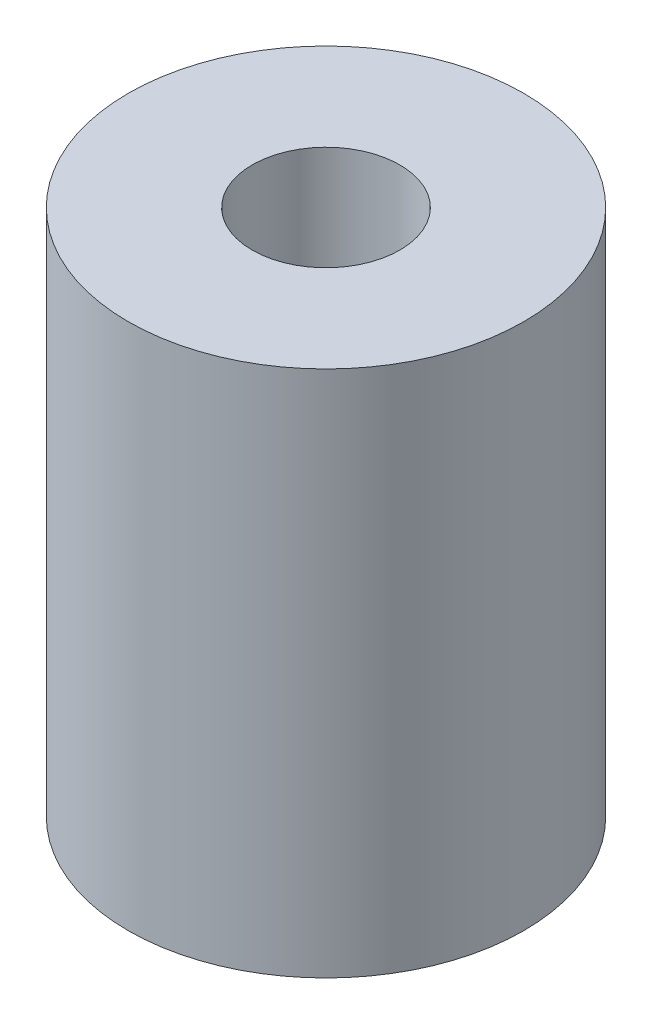
from build123d import *

# Parameters (mm, degrees)
SKETCH1_R           = 7.5
SKETCH1_R_2         = 2.8
BOSS_EXTRUDE1_DEPTH = 20


with BuildPart() as part:
    # Sketch1 → Boss-Extrude1 (new body)
    with BuildSketch(Plane(origin=(0, 0, 0), x_dir=(1, 0, 0), z_dir=(0, 1, 0))):
        with Locations(Location((0, 0, 0), (0, 0, 270))):
            Circle(SKETCH1_R)
        with Locations(Location((0, 0, 0), (0, 0, 270))):
            Circle(SKETCH1_R_2, mode=Mode.SUBTRACT)
    extrude(amount=BOSS_EXTRUDE1_DEPTH)


solid = part.part
